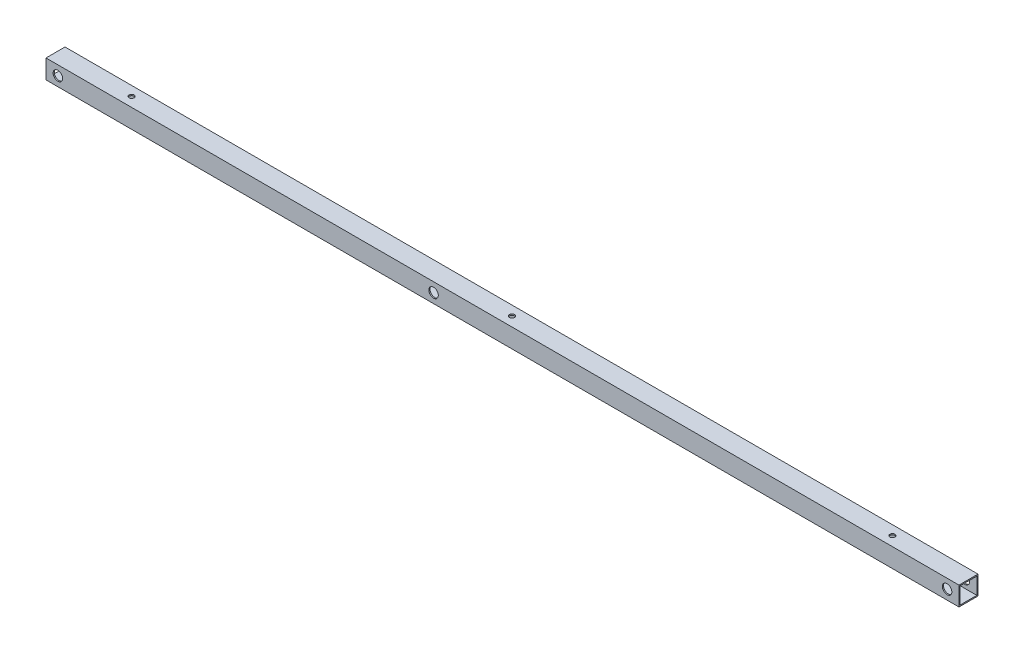
from build123d import *

# Parameters (mm, degrees)
SKETCH1_W                  = 25.4
SKETCH1_H                  = 25.4
SKETCH1_W_2                = 22.225
SKETCH1_H_2                = 22.225
EXTRUDE_THIN1_DEPTH        = 609.6
F_1_2_0_5_DIAMETER_HOLE1_D = 12.7
F_1_4_CLEARANCE_HOLE1_D    = 6.7564


with BuildPart() as part:
    # Sketch1 → Extrude-Thin1 (new, symmetric)
    with BuildSketch(Plane(origin=(0, 0, 0), x_dir=(0, 0, -1), z_dir=(1, 0, 0))):
        Rectangle(SKETCH1_W, SKETCH1_H)
        Rectangle(SKETCH1_W_2, SKETCH1_H_2, mode=Mode.SUBTRACT)
    extrude(amount=EXTRUDE_THIN1_DEPTH, both=True)

    # 1/2 (0.5) Diameter Hole1 (through all)
    with Locations(Plane.XY.offset(12.7)):
        with Locations((-593.725, 0), (593.725, 0), (-92.075, 0)):
            Hole(F_1_2_0_5_DIAMETER_HOLE1_D / 2)

    # 1/4 Clearance Hole1 (through all)
    with Locations(Plane(origin=(0, 12.7, 0), x_dir=(1, 0, 0), z_dir=(0, 1, 0))):
        with Locations((-508, 0), (0, 0), (508, 0)):
            Hole(F_1_4_CLEARANCE_HOLE1_D / 2)


solid = part.part
